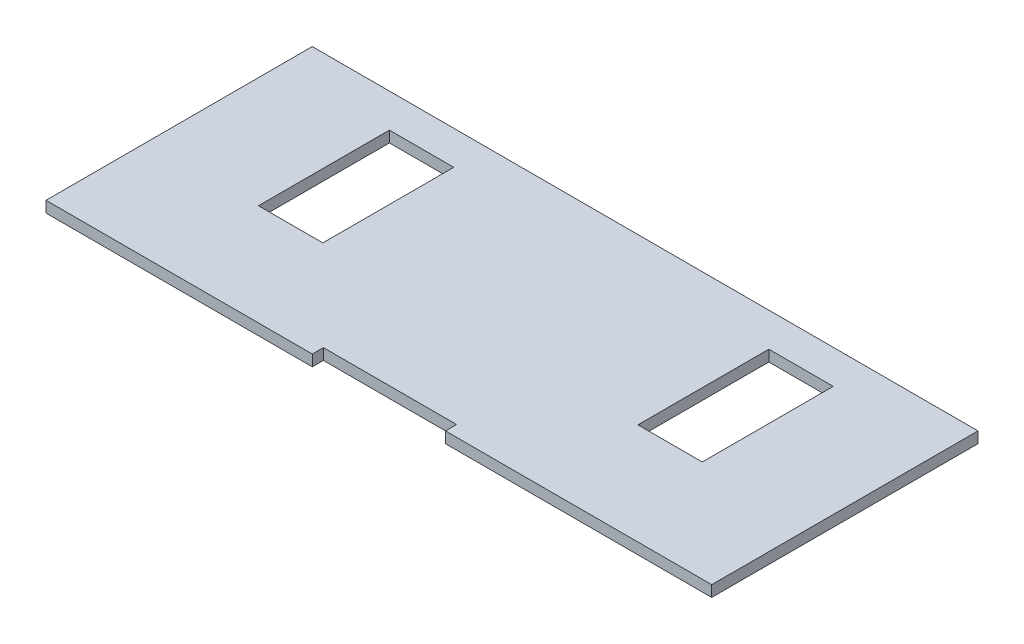
from build123d import *

# Parameters (mm, degrees)
SKETCH1_W           = 300
SKETCH1_H           = 120
BOSS_EXTRUDE1_DEPTH = 5
SKETCH2_W           = 29
SKETCH2_H           = 59
SKETCH2_W_2         = 60
SKETCH2_H_2         = 5
CUT_EXTRUDE1_DEPTH  = 5


with BuildPart() as part:
    # Sketch1 → Boss-Extrude1 (new body)
    with BuildSketch(Plane(origin=(0, 0, 0), x_dir=(1, 0, 0), z_dir=(0, 1, 0))):
        with Locations((-150, 60)):
            Rectangle(SKETCH1_W, SKETCH1_H)
    extrude(amount=BOSS_EXTRUDE1_DEPTH)

    # Sketch2 → Cut-Extrude1 (cut)
    with BuildSketch(Plane(origin=(0, 5, 0), x_dir=(1, 0, 0), z_dir=(0, 1, 0))):
        with Locations((-64.5, 75.25)):
            Rectangle(SKETCH2_W, SKETCH2_H)
        with Locations((-235.5, 75.25)):
            Rectangle(SKETCH2_W, SKETCH2_H)
        with Locations((-150, 2.5)):
            Rectangle(SKETCH2_W_2, SKETCH2_H_2)
    extrude(amount=-CUT_EXTRUDE1_DEPTH, mode=Mode.SUBTRACT)


solid = part.part
